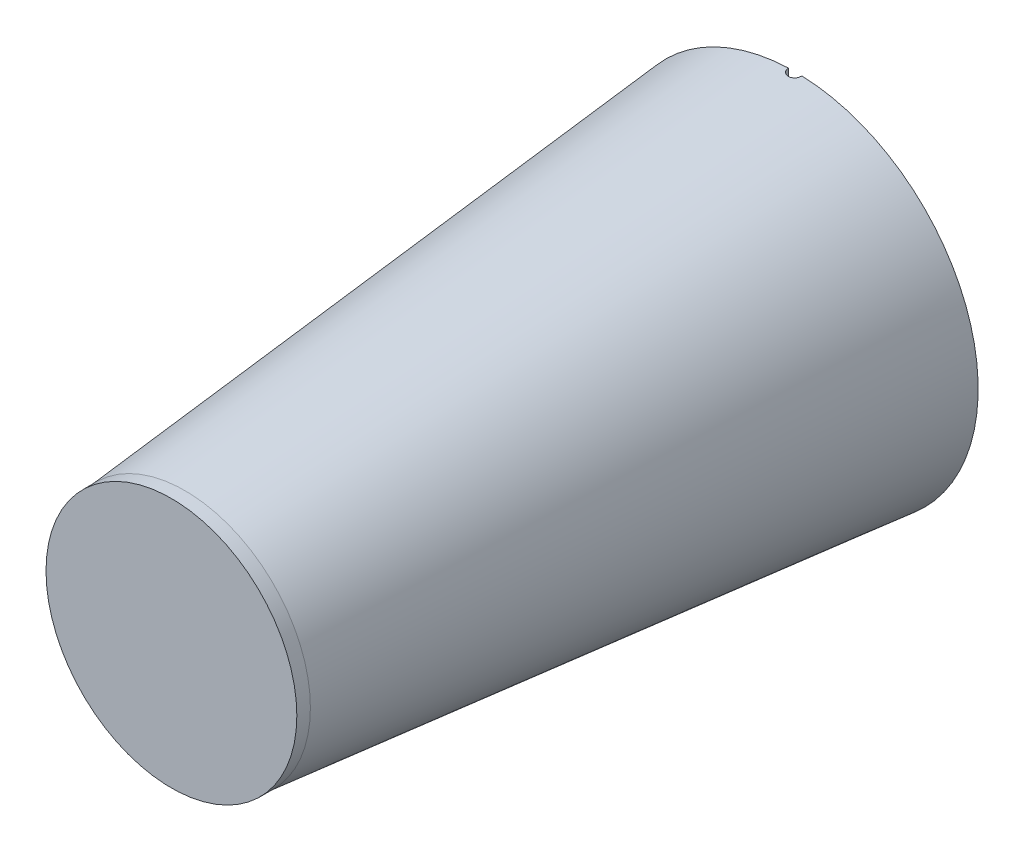
from build123d import *

# Parameters (mm, degrees)
SHELL3_T                = -3.175
SKETCH5_R               = 29.36875
BOSS_EXTRUDE1_DEPTH     = 3.175
FILLET1_R               = 3.175
CUT_EXTRUDE1_DEPTH      = 156.201976268
CUT_EXTRUDE1_DEPTH_BACK = 156.201976268
SKETCH6_R               = 1.5875


with BuildPart() as part:
    # Sketch2 → Revolve1 (revolve)
    with BuildSketch(Plane(origin=(0, 0, 0), x_dir=(1, 0, 0), z_dir=(0, 1, 0))):
        Polygon((29.36875, 0), (0, 0), (0, 142.875), (42.8625, 142.875), align=None)
    revolve(axis=Axis((0, 0, 0), (0, 0, -1)))

    # Shell3
    shell3_openings = [part.faces().sort_by_distance(p)[0] for p in [
        (0, 0, -142.875),
    ]]
    offset(amount=SHELL3_T, openings=shell3_openings, kind=Kind.INTERSECTION)

    # Sketch5 → Boss-Extrude1 (add)
    with BuildSketch(Plane.XY):
        Circle(SKETCH5_R)
    extrude(amount=BOSS_EXTRUDE1_DEPTH)

    # Fillet1
    fillet1_edges = [part.edges().sort_by_distance(p)[0] for p in [
        (-26.479482439, 0, -3.175),
    ]]
    fillet(fillet1_edges, radius=FILLET1_R)

    # Sketch6 → Cut-Extrude1 (cut, two sides: drawn at the far end of the back side and taken through both)
    with BuildSketch(Plane(origin=(0, 0, 0), x_dir=(1, 0, 0), z_dir=(0, 1, 0)).offset(-CUT_EXTRUDE1_DEPTH_BACK)):
        with Locations((0, 142.875)):
            Circle(SKETCH6_R)
    extrude(amount=CUT_EXTRUDE1_DEPTH + CUT_EXTRUDE1_DEPTH_BACK, mode=Mode.SUBTRACT)


solid = part.part
